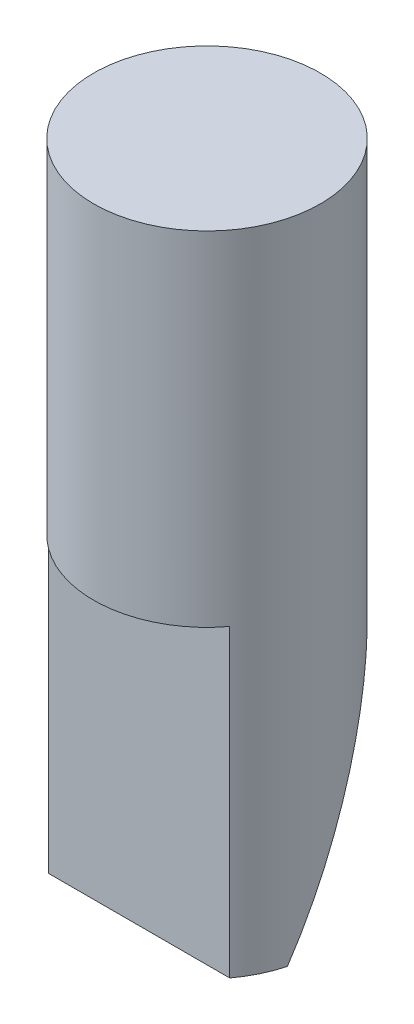
from build123d import *

# Parameters (mm, degrees)
SKIZZE1_R                            = 17.5
AUFSATZ_LINEAR_AUSTRAGEN1_DEPTH      = 100
SCHNITT_LINEAR_AUSTRAGEN1_DEPTH      = 104.01698889
SCHNITT_LINEAR_AUSTRAGEN1_DEPTH_BACK = 104.01698889
SKIZZE2_W                            = 7
SKIZZE2_H                            = 47


with BuildPart() as part:
    # Skizze1 → Aufsatz-Linear austragen1 (new body)
    with BuildSketch(Plane(origin=(0, 0, 0), x_dir=(1, 0, 0), z_dir=(0, 1, 0))):
        with Locations(Location((0, 0, 0), (0, 0, 270))):
            Circle(SKIZZE1_R)
    extrude(amount=AUFSATZ_LINEAR_AUSTRAGEN1_DEPTH)

    # Skizze2 → Schnitt-Linear austragen1 (cut, two sides: drawn at the far end of the back side and taken through both)
    with BuildSketch(Plane(origin=(0, 0, 0), x_dir=(0, 0, -1), z_dir=(1, 0, 0)).offset(-SCHNITT_LINEAR_AUSTRAGEN1_DEPTH_BACK)):
        with Locations((-14, 23.5)):
            Rectangle(SKIZZE2_W, SKIZZE2_H)
        Polygon((-4.5, 0), (17.5, 47), (17.5, 0), align=None)
    extrude(amount=SCHNITT_LINEAR_AUSTRAGEN1_DEPTH + SCHNITT_LINEAR_AUSTRAGEN1_DEPTH_BACK, mode=Mode.SUBTRACT)


solid = part.part
